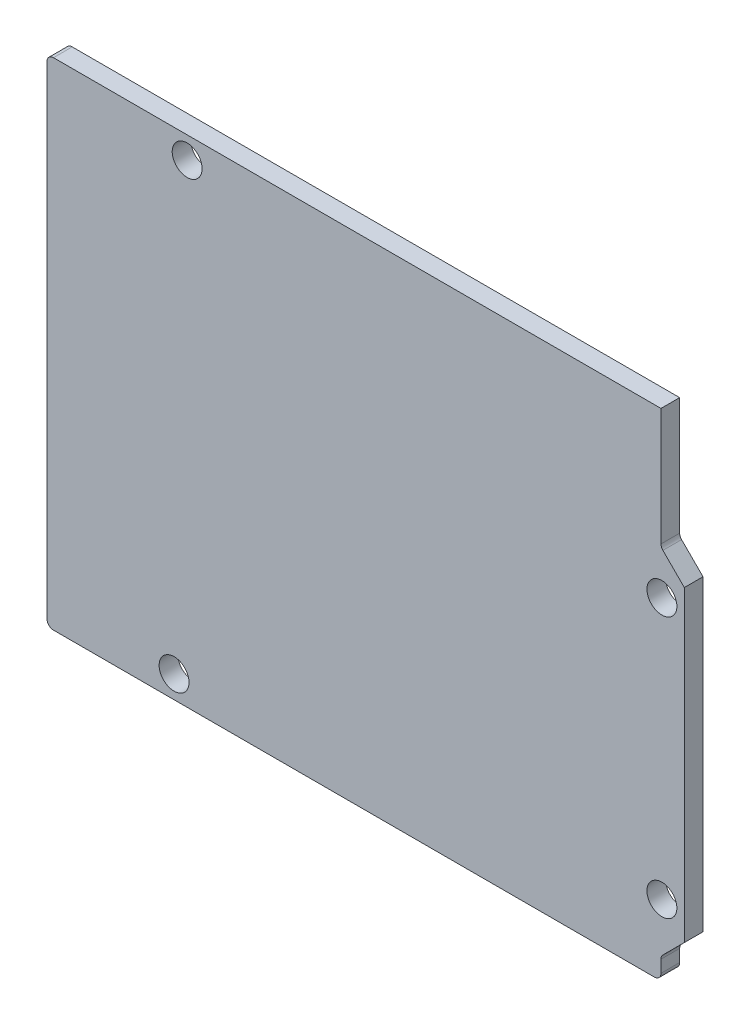
from build123d import *

# Parameters (mm, degrees)
BOSS_EXTRUDE1_START = 2.5
SKETCH1_R           = 1.6
BOSS_EXTRUDE1_DEPTH = 2


with BuildPart() as part:
    # Sketch1 → Boss-Extrude1 (new body)
    with BuildSketch(Plane.XY.offset(BOSS_EXTRUDE1_START)):
        with BuildLine():
            Line((-36.508029185, -42.375), (-36.508029185, -94.025))
            ThreePointArc((-36.508029185, -94.025), (-36.303003932, -94.519974747), (-35.808029185, -94.725))
            Line((-35.808029185, -94.725), (28.491970815, -94.725))
            ThreePointArc((28.491970815, -94.725), (28.986945562, -94.519974747), (29.191970815, -94.025))
            Line((29.191970815, -94.025), (29.191970815, -92.714949494))
            ThreePointArc((29.191970815, -92.714949494), (29.245255142, -92.447071091), (29.396996068, -92.219974747))
            Line((29.396996068, -92.219974747), (31.691970815, -89.925))
            Line((31.691970815, -89.925), (31.691970815, -57.025))
            Line((31.691970815, -57.025), (29.396996068, -54.730025253))
            ThreePointArc((29.396996068, -54.730025253), (29.245255142, -54.502928909), (29.191970815, -54.235050506))
            Line((29.191970815, -54.235050506), (29.191970815, -41.675))
            Line((29.191970815, -41.675), (-35.808029185, -41.675))
            ThreePointArc((-35.808029185, -41.675), (-36.303003932, -41.880025253), (-36.508029185, -42.375))
        make_face()
        with Locations((-21.508029185, -44.025)):
            Circle(SKETCH1_R, mode=Mode.SUBTRACT)
        with Locations((-22.908029185, -92.325)):
            Circle(SKETCH1_R, mode=Mode.SUBTRACT)
        with Locations((29.291970815, -59.175)):
            Circle(SKETCH1_R, mode=Mode.SUBTRACT)
        with Locations((29.291970815, -87.125)):
            Circle(SKETCH1_R, mode=Mode.SUBTRACT)
    extrude(amount=BOSS_EXTRUDE1_DEPTH)


solid = part.part
